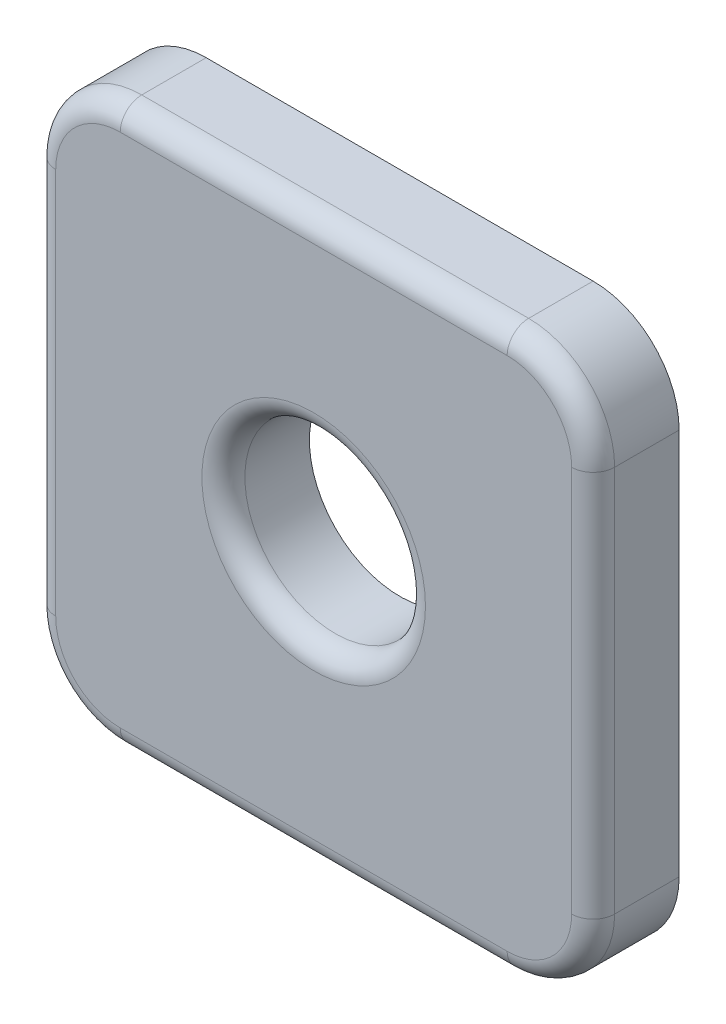
from build123d import *

# Parameters (mm, degrees)
ESQUISSE1_W        = 13
ESQUISSE1_H        = 13
ESQUISSE1_R        = 2.1
BOSS_EXTRU_1_DEPTH = 2
CONG_1_R           = 2
CONG_2_R           = 0.5


with BuildPart() as part:
    # Esquisse1 → Boss.-Extru.1 (new body)
    with BuildSketch(Plane.XY):
        with Locations((-5.035571526, 2.289308176)):
            Rectangle(ESQUISSE1_W, ESQUISSE1_H)
        with Locations((-5.035571526, 2.289308176)):
            Circle(ESQUISSE1_R, mode=Mode.SUBTRACT)
    extrude(amount=BOSS_EXTRU_1_DEPTH)

    # Congé1
    cong_1_edges = [part.edges().sort_by_distance(p)[0] for p in [
        (1.464428474, -4.210691824, 1),
        (-11.535571526, -4.210691824, 1),
        (-11.535571526, 8.789308176, 1),
        (1.464428474, 8.789308176, 1),
    ]]
    fillet(cong_1_edges, radius=CONG_1_R)

    # Congé2
    cong_2_edges = [part.edges().sort_by_distance(p)[0] for p in [
        (-7.135571526, 2.289308176, 2),
        (-5.035571526, -4.210691824, 2),
        (-11.535571526, 2.289308176, 2),
        (1.464428474, 2.289308176, 2),
        (-5.035571526, 8.789308176, 2),
        (0.878642036, 8.203521738, 2),
        (-10.949785089, 8.203521738, 2),
        (0.878642036, -3.624905386, 2),
        (-10.949785089, -3.624905386, 2),
    ]]
    fillet(cong_2_edges, radius=CONG_2_R)


solid = part.part
